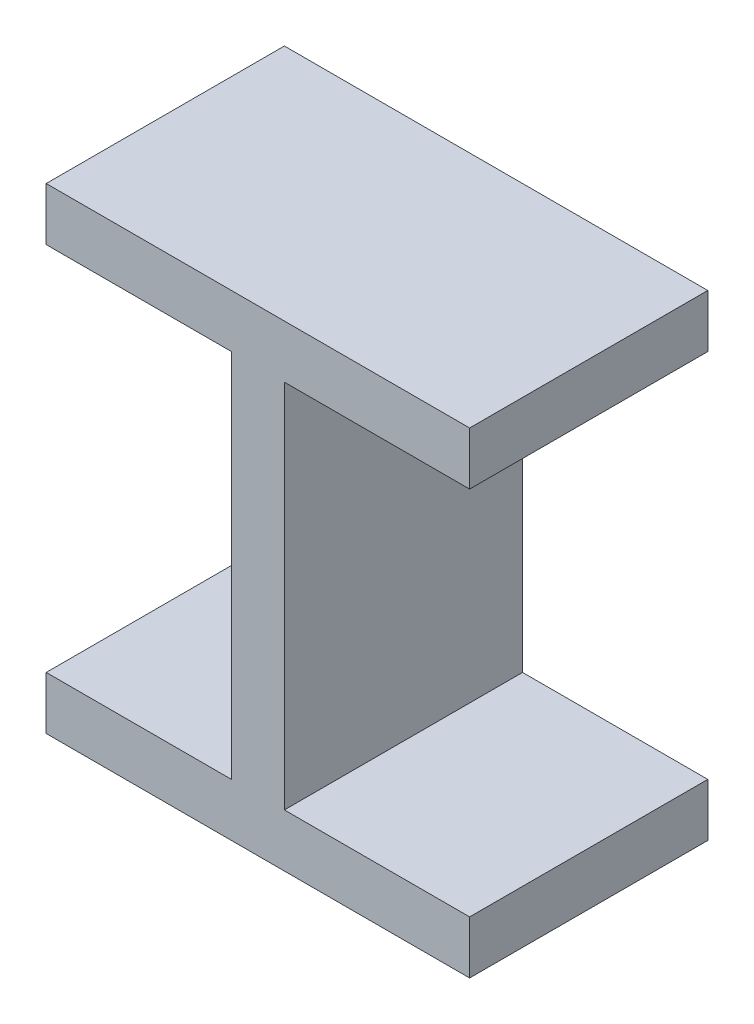
from build123d import *

# Parameters (mm, degrees)
BOSS_EXTRUDE1_DEPTH = 90


with BuildPart() as part:
    # Sketch1 → Boss-Extrude1 (new body)
    with BuildSketch(Plane.XY):
        Polygon((80, -90), (-80, -90), (-80, -70), (-10, -70), (-10, 70), (-80, 70), (-80, 90), (80, 90), (80, 70), (10, 70), (10, -70), (80, -70), align=None)
    extrude(amount=BOSS_EXTRUDE1_DEPTH)


solid = part.part
